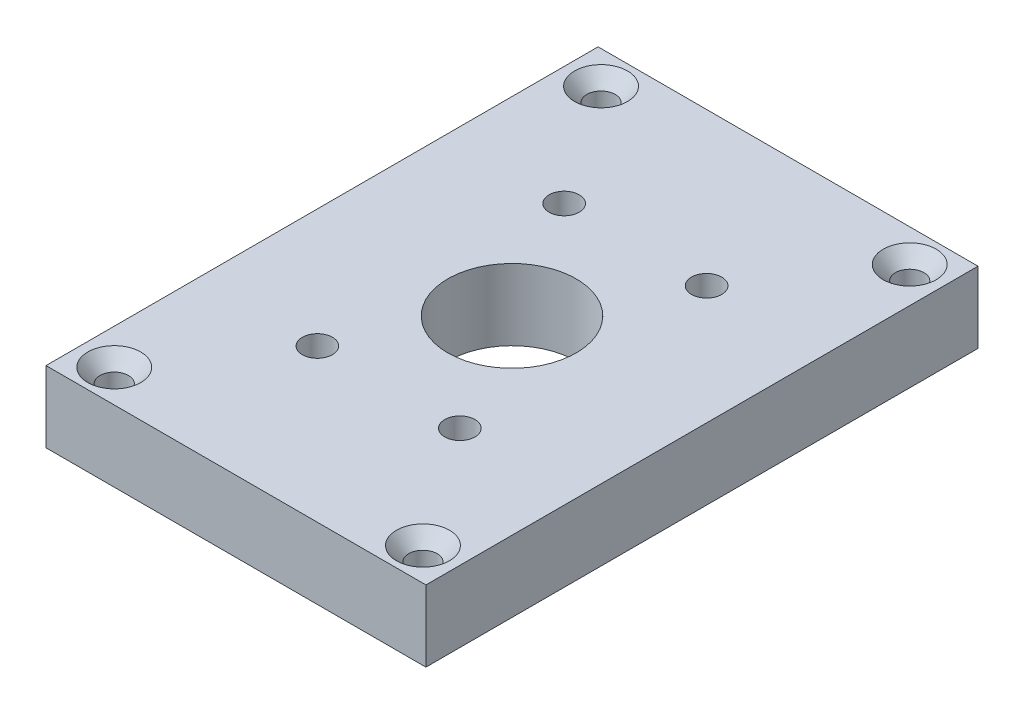
from build123d import *

# Parameters (mm, degrees)
SKETCH1_W                                      = 50.8
SKETCH1_H                                      = 73.81875
BOSS_EXTRUDE1_DEPTH                            = 9.525
CSK_FOR_6_FLAT_HEAD_MACHINE_SCREW1_D           = 3.7973
CSK_FOR_6_FLAT_HEAD_MACHINE_SCREW1_CSINK_D     = 7.0866
CSK_FOR_6_FLAT_HEAD_MACHINE_SCREW1_CSINK_ANGLE = 82
CUT_EXTRUDE1_DASH_036_DEPTH                    = 1.3208
SKETCH5_R                                      = 8.5852
CUT_EXTRUDE1_DEPTH                             = 46.805977644
CIRPATTERN1_COUNT                              = 6


with BuildPart() as part:
    # Sketch1 → Boss-Extrude1 (new body)
    with BuildSketch(Plane(origin=(0, 0, 0), x_dir=(1, 0, 0), z_dir=(0, 1, 0))):
        Rectangle(SKETCH1_W, SKETCH1_H)
    extrude(amount=BOSS_EXTRUDE1_DEPTH)

    # CSK for #6 Flat Head Machine Screw1 (through all)
    with Locations(Plane(origin=(0, 9.525, 0), x_dir=(-1, 0, 0), z_dir=(0, 1, 0))):
        with Locations((20.6375, -32.54375), (-20.6375, -32.54375), (-20.6375, 32.54375), (20.6375, 32.54375)):
            CounterSinkHole(CSK_FOR_6_FLAT_HEAD_MACHINE_SCREW1_D / 2, CSK_FOR_6_FLAT_HEAD_MACHINE_SCREW1_CSINK_D / 2, counter_sink_angle=CSK_FOR_6_FLAT_HEAD_MACHINE_SCREW1_CSINK_ANGLE)

    # Sketch4 → Cut-Extrude1 - dash 036 (cut)
    with BuildSketch(Plane(origin=(0, 0, 0), x_dir=(-1, 0, 0), z_dir=(0, -1, 0))):
        with BuildLine():
            Line((-11.1125, 34.6075), (11.1125, 34.6075))
            ThreePointArc((11.1125, 34.6075), (17.147232113, 32.107832113), (19.6469, 26.0731))
            Line((19.6469, 26.0731), (19.6469, -26.0731))
            ThreePointArc((19.6469, -26.0731), (17.147232113, -32.107832113), (11.1125, -34.6075))
            Line((11.1125, -34.6075), (-11.1125, -34.6075))
            ThreePointArc((-11.1125, -34.6075), (-17.147232113, -32.107832113), (-19.6469, -26.0731))
            Line((-19.6469, -26.0731), (-19.6469, 26.0731))
            ThreePointArc((-19.6469, 26.0731), (-17.147232113, 32.107832113), (-11.1125, 34.6075))
        make_face()
        with BuildLine():
            Line((-11.1125, -32.4231), (11.1125, -32.4231))
            ThreePointArc((11.1125, -32.4231), (15.602628061, -30.563228061), (17.4625, -26.0731))
            Line((17.4625, -26.0731), (17.4625, 26.0731))
            ThreePointArc((17.4625, 26.0731), (15.602628061, 30.563228061), (11.1125, 32.4231))
            Line((11.1125, 32.4231), (-11.1125, 32.4231))
            ThreePointArc((-11.1125, 32.4231), (-15.602628061, 30.563228061), (-17.4625, 26.0731))
            Line((-17.4625, 26.0731), (-17.4625, -26.0731))
            ThreePointArc((-17.4625, -26.0731), (-15.602628061, -30.563228061), (-11.1125, -32.4231))
        make_face(mode=Mode.SUBTRACT)
    extrude(amount=-CUT_EXTRUDE1_DASH_036_DEPTH, mode=Mode.SUBTRACT)

    # Sketch5 → Cut-Extrude1 (cut, through all)
    with BuildSketch(Plane(origin=(0, 9.525, 0), x_dir=(1, 0, 0), z_dir=(0, 1, 0))):
        with Locations(Location((0, 0, 0), (0, 0, 270))):
            Circle(SKETCH5_R)
    extrude(amount=-CUT_EXTRUDE1_DEPTH, mode=Mode.SUBTRACT)

    # Sketch9 → #10-32 Tapped Hole2 (revolve, cut)
    with BuildSketch(Plane(origin=(9.525, 9.525, -16.497783942), x_dir=(0, 0, 1), z_dir=(1, 0, 0))):
        Polygon((0, 0), (0, 7.563317848), (2.0193, 6.35), (2.0193, 0), align=None)
    f_10_32_tapped_hole2 = revolve(axis=Axis((9.525, 15.875, -16.497783942), (0, -1, 0)), mode=Mode.SUBTRACT)

    # CirPattern1: #10-32 Tapped Hole2 ×6 about axis, 2 skipped
    cirpattern1_axis = Axis((0, 0, 0), (0, 1, 0))
    add([f_10_32_tapped_hole2.rotate(cirpattern1_axis, i * 360 / CIRPATTERN1_COUNT) for i in range(1, CIRPATTERN1_COUNT) if i not in (2, 5)], mode=Mode.SUBTRACT)


solid = part.part
